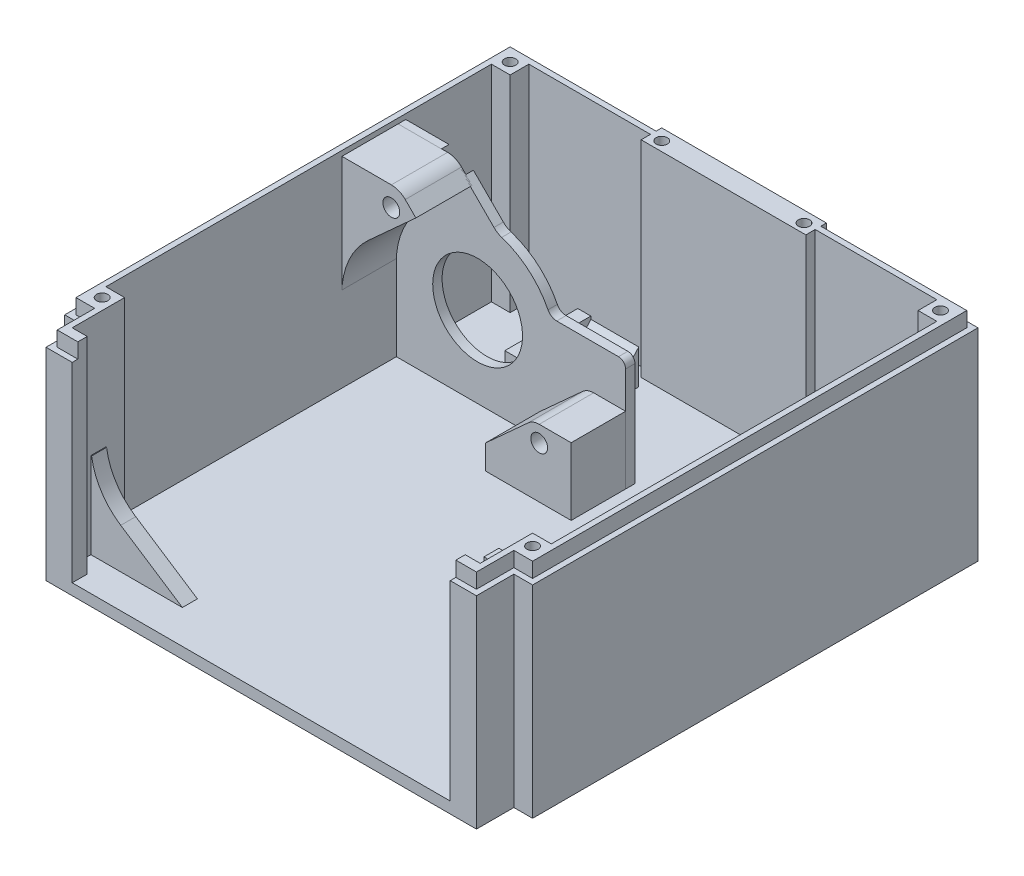
from build123d import *

# Parameters (mm, degrees)
BOSS_EXTRUDE1_DEPTH          = 3
SKETCH2_R                    = 1.5
BOSS_EXTRUDE2_DEPTH          = 55
SKETCH14_R                   = 12
SKETCH14_W                   = 1.116798897
SKETCH14_H                   = 21.636114375
BOSS_EXTRUDE10_DEPTH         = 2.5
SKETCH21_R                   = 2.25
BOSS_EXTRUDE11_DEPTH         = 15
BOSS_EXTRUDE11_2_DEPTH       = 15
CUT_EXTRUDE_THIN2_DEPTH      = 107.913516451
CUT_EXTRUDE_THIN2_DEPTH_BACK = 4
BOSS_EXTRUDE15_REACH         = 107.316
BOSS_EXTRUDE15_END_RADIUS    = 12.0269
SKETCH23_W                   = 12.784976471
SKETCH23_H                   = 19.5
SKETCH28_W                   = 3.5
SKETCH28_H                   = 19.5
BOSS_EXTRUDE16_DEPTH         = 10
SKETCH29_W                   = 6
SKETCH29_H                   = 2.5
CUT_EXTRUDE9_DEPTH           = 21
SKETCH31_R                   = 5.5
SKETCH31_R_2                 = 2.25
CUT_EXTRUDE10_DEPTH          = 2
SKETCH35_W                   = 4
SKETCH35_H                   = 52
BOSS_EXTRUDE20_DEPTH         = 4
BOSS_EXTRUDE20_2_DEPTH       = 4
CUT_EXTRUDE18_DEPTH          = 55


with BuildPart() as part:
    # Sketch1 → Boss-Extrude1 (new body)
    with BuildSketch(Plane(origin=(0, 0, 0), x_dir=(1, 0, 0), z_dir=(0, 1, 0))):
        Polygon((-57.5, -54.5), (-57.5, -64.5), (57.5, -64.5), (57.5, -54.5), (62.5, -54.5), (62.5, 64.5), (-62.5, 64.5), (-62.5, -54.5), align=None)
    extrude(amount=BOSS_EXTRUDE1_DEPTH)

    # Sketch2 → Boss-Extrude2 (add)
    with BuildSketch(Plane(origin=(0, 3, 0), x_dir=(1, 0, 0), z_dir=(0, 1, 0))):
        Polygon((57.5, -64.5), (57.5, -54.5), (62.5, -54.5), (62.5, 64.5), (0, 64.5), (-62.5, 64.5), (-62.5, -54.5), (-57.5, -54.5), (-57.5, -64.5), align=None)
        with Locations(Location((-57.5, -49.5, 0), (0, 0, 270))):
            Circle(SKETCH2_R, mode=Mode.SUBTRACT)
        Polygon((-22, 59), (22, 59), (22, 61.5), (54.5, 61.5), (54.5, 56.5), (59.5, 56.5), (59.5, -46.5), (54.5, -46.5), (54.5, -58.5), (-54.5, -58.5), (-54.5, -46.5), (-59.5, -46.5), (-59.5, 56.5), (-54.5, 56.5), (-54.5, 61.5), (-22, 61.5), align=None, mode=Mode.SUBTRACT)
        with Locations(Location((-57.5, 59.5, 0), (0, 0, 270))):
            Circle(SKETCH2_R, mode=Mode.SUBTRACT)
        with Locations(Location((-19, 61.5, 0), (0, 0, 270))):
            Circle(SKETCH2_R, mode=Mode.SUBTRACT)
        with Locations(Location((19, 61.5, 0), (0, 0, 270))):
            Circle(SKETCH2_R, mode=Mode.SUBTRACT)
        with Locations(Location((57.5, 59.5, 0), (0, 0, 270))):
            Circle(SKETCH2_R, mode=Mode.SUBTRACT)
        with Locations(Location((57.5, -49.5, 0), (0, 0, 270))):
            Circle(SKETCH2_R, mode=Mode.SUBTRACT)
    extrude(amount=BOSS_EXTRUDE2_DEPTH)

    # Sketch22 → Cut-Extrude-Thin2 (cut, two sides: drawn at the far end of the back side and taken through both)
    with BuildSketch(Plane(origin=(0, 58, 0), x_dir=(1, 0, 0), z_dir=(0, 1, 0)).offset(-CUT_EXTRUDE_THIN2_DEPTH_BACK)):
        Polygon((-22, 64.5), (-62.5, 64.5), (-62.5, -54.5), (-57.5, -54.5), (-57.5, -64.5), (57.5, -64.5), (57.5, -54.5), (62.5, -54.5), (62.5, 64.5), (22, 64.5), (22, 63), (61, 63), (61, -53), (56, -53), (56, -63), (-56, -63), (-56, -53), (-61, -53), (-61, 63), (-22, 63), align=None)
    extrude(amount=CUT_EXTRUDE_THIN2_DEPTH + CUT_EXTRUDE_THIN2_DEPTH_BACK, mode=Mode.SUBTRACT)

    # Boss-Extrude15: up to this cylinder (the profile starts outside it)
    boss_extrude15_end = Plane(origin=(0, 19.5875, -46.975), z_dir=(-1, 0, 0)) * Cylinder(BOSS_EXTRUDE15_END_RADIUS, 292.760292, mode=Mode.PRIVATE)
    # Sketch23 → Boss-Extrude15 (add, up to the surface)
    with BuildSketch(Plane(origin=(0, 3, 0), x_dir=(1, 0, 0), z_dir=(0, 1, 0)), mode=Mode.PRIVATE) as boss_extrude15_sk1:
        with Locations((26.537246289, 46.75)):
            Rectangle(SKETCH23_W, SKETCH23_H)
    boss_extrude15_tool1 = extrude(boss_extrude15_sk1.sketch, amount=BOSS_EXTRUDE15_REACH, mode=Mode.PRIVATE) - boss_extrude15_end
    add(boss_extrude15_tool1.solids().sort_by_distance((26.537246, 3, -46.75))[0])
    # Sketch23 → Boss-Extrude15 (add, up to the surface)
    with BuildSketch(Plane(origin=(0, 3, 0), x_dir=(1, 0, 0), z_dir=(0, 1, 0)), mode=Mode.PRIVATE) as boss_extrude15_sk2:
        with Locations((-26.537246289, 46.75)):
            Rectangle(SKETCH23_W, SKETCH23_H)
    boss_extrude15_tool2 = extrude(boss_extrude15_sk2.sketch, amount=BOSS_EXTRUDE15_REACH, mode=Mode.PRIVATE) - boss_extrude15_end
    add(boss_extrude15_tool2.solids().sort_by_distance((-26.537246, 3, -46.75))[0])

    # Sketch28 → Boss-Extrude16 (add)
    with BuildSketch(Plane(origin=(0, 3, 0), x_dir=(1, 0, 0), z_dir=(0, 1, 0))):
        with Locations((-34.679734524, 46.75)):
            Rectangle(SKETCH28_W, SKETCH28_H)
        with Locations((34.679734524, 46.75)):
            Rectangle(SKETCH28_W, SKETCH28_H)
    extrude(amount=BOSS_EXTRUDE16_DEPTH)

    # Sketch29 → Cut-Extrude9 (cut)
    with BuildSketch(Plane.XY.offset(-37)):
        with Locations((-26.800748972, 4.264488043)):
            Rectangle(SKETCH29_W, SKETCH29_H)
        with Locations((26.902468668, 4.264488043)):
            Rectangle(SKETCH29_W, SKETCH29_H)
    extrude(amount=-CUT_EXTRUDE9_DEPTH, mode=Mode.SUBTRACT)

    # Sketch36 → Cut-Extrude18 (cut)
    with BuildSketch(Plane(origin=(0, 58, 0), x_dir=(1, 0, 0), z_dir=(0, 1, 0))):
        Polygon((-54.5, -60.5), (-50.5, -60.5), (-50.5, -64.5), (50.5, -64.5), (50.5, -60.5), (54.5, -60.5), (54.5, -55.5), (-54.5, -55.5), align=None)
    extrude(amount=-CUT_EXTRUDE18_DEPTH, mode=Mode.SUBTRACT)


with BuildPart() as body_2:
    # Sketch14 → Boss-Extrude10 (new body)
    # profile 1 of 10: a face of its own
    with BuildSketch(Plane(origin=(0, 0, -31.119001714), x_dir=(-1, 0, 0), z_dir=(0, 0, -1))):
        with BuildLine():
            ThreePointArc((-1.59584635, 23.545273827), (-1.697128881, 23.891187217), (-1.731299201, 24.25))
            Line((-1.731299201, 24.25), (-1.731299201, 3))
            Line((-1.731299201, 3), (58.856776147, 3))
            Line((58.856776147, 3), (58.856776147, 24.636114375))
            ThreePointArc((58.856776147, 24.636114375), (46.326717946, 5.386759507), (23.652937249, 9.052777819))
            Line((23.652937249, 9.052777819), (20.029318508, 12.343765137))
            ThreePointArc((20.029318508, 12.343765137), (18.95461959, 13.077151659), (17.720322917, 13.488667491))
            Line((17.720322917, 13.488667491), (18.204971966, 13.049203274))
            add(Edge.make_bspline(
                [(18.204971966, 13.049203274), (17.633265391, 13.567608463), (16.861430926, 13.567608463)],
                knots=[0.344197313, 0.344197313, 0.344197313, 1.080722269, 1.080722269, 1.080722269], degree=2, weights=[1, 0.932954253, 1]))
            Line((16.861430926, 13.567608463), (11.576216454, 13.567608463))
            add(Edge.make_bspline(
                [(11.576216454, 13.567608463), (11.161964807, 13.567608463), (10.869078119, 13.274721775)],
                knots=[5.212883045, 5.212883045, 5.212883045, 5.998256201, 5.998256201, 5.998256201], degree=2, weights=[1, 0.923884317, 1]))
            Line((10.869078119, 13.274721775), (10.51813319, 12.923776846))
            ThreePointArc((10.51813319, 12.923776846), (5.894136115, 11.465836169), (2.047645264, 14.417352407))
            Line((2.047645264, 14.417352407), (-1.61850388, 22.279505041))
            add(Edge.make_bspline(
                [(-1.61850388, 22.279505041), (-1.303116197, 21.995089756), (-0.911492557, 21.830784457)],
                knots=[0.051587875, 0.051587875, 0.051587875, 0.388465815, 0.388465815, 0.388465815], degree=2, weights=[1, 0.969446087, 0.966947037]))
            Line((-0.911492557, 21.830784457), (-1.59584635, 23.545273827))
        make_face()
    # profile 2 of 10: a face of its own
    with BuildSketch(Plane(origin=(0, 0, -31.119001714), x_dir=(-1, 0, 0), z_dir=(0, 0, -1))):
        with BuildLine():
            Line((-1.731299201, 30.772228751), (-1.731299201, 24.25))
            ThreePointArc((-1.731299201, 24.25), (-1.697128881, 23.891187217), (-1.59584635, 23.545273827))
            ThreePointArc((-1.59584635, 23.545273827), (-0.89663389, 22.67624692), (0.169681285, 22.349019514))
            Line((0.169681285, 22.349019514), (6.849741216, 22.349019514))
            ThreePointArc((6.849741216, 22.349019514), (8.867461366, 21.972817718), (10.614037633, 20.894766821))
            Line((10.614037633, 20.894766821), (20.029318508, 12.343765137))
            Line((20.029318508, 12.343765137), (23.652937249, 9.052777819))
            ThreePointArc((23.652937249, 9.052777819), (46.326717946, 5.386759507), (58.856776147, 24.636114375))
            ThreePointArc((58.856776147, 24.636114375), (57.121955076, 33.004493243), (52.203426683, 39.993588138))
            ThreePointArc((52.203426683, 39.993588138), (42.422819909, 45.174538524), (31.365884521, 44.67785392))
            ThreePointArc((31.365884521, 44.67785392), (24.122107987, 40.633003795), (19.00380593, 34.103371718))
            ThreePointArc((19.00380593, 34.103371718), (18.045725644, 33.059449427), (16.682453808, 32.673209237))
            Line((16.682453808, 32.673209237), (0.169681285, 32.673209237))
            ThreePointArc((0.169681285, 32.673209237), (-1.174514908, 32.116424943), (-1.731299201, 30.772228751))
        make_face()
        with Locations((37.80579566, 24.636114375)):
            Circle(SKETCH14_R, mode=Mode.SUBTRACT)
    # profile 3 of 10: a face of its own
    with BuildSketch(Plane(origin=(0, 0, -31.119001714), x_dir=(-1, 0, 0), z_dir=(0, 0, -1))):
        with BuildLine():
            ThreePointArc((0.169681285, 22.349019514), (-0.89663389, 22.67624692), (-1.59584635, 23.545273827))
            Line((-1.59584635, 23.545273827), (-0.911492557, 21.830784457))
            add(Edge.make_bspline(
                [(-0.911492557, 21.830784457), (-0.447494096, 21.636114375), (0.055700468, 21.636114375)],
                knots=[0.388465815, 0.388465815, 0.388465815, 0.785360087, 0.785360087, 0.785360087], degree=2, weights=[0.966947037, 0.964002769, 1]))
            Line((0.055700468, 21.636114375), (6.805869125, 21.636114375))
            add(Edge.make_bspline(
                [(10.164391553, 20.340143754), (8.735171821, 21.636114375), (6.805869125, 21.636114375)],
                knots=[5.914929134, 5.914929134, 5.914929134, 6.651441481, 6.651441481, 6.651441481], degree=2, weights=[1, 0.932956522, 1]))
            Line((10.164391553, 20.340143754), (17.720322917, 13.488667491))
            ThreePointArc((17.720322917, 13.488667491), (18.95461959, 13.077151659), (20.029318508, 12.343765137))
            Line((20.029318508, 12.343765137), (10.614037633, 20.894766821))
            ThreePointArc((10.614037633, 20.894766821), (8.867461366, 21.972817718), (6.849741216, 22.349019514))
            Line((6.849741216, 22.349019514), (0.169681285, 22.349019514))
        make_face()
    # profile 4 of 10: a face of its own
    with BuildSketch(Plane(origin=(0, 0, -31.119001714), x_dir=(-1, 0, 0), z_dir=(0, 0, -1))):
        with Locations((59.415175596, 13.818057188)):
            Rectangle(SKETCH14_W, SKETCH14_H)
    # profile 5 of 10: a face of its own
    with BuildSketch(Plane(origin=(0, 0, -31.119001714), x_dir=(-1, 0, 0), z_dir=(0, 0, -1))):
        with BuildLine():
            add(Edge.make_bspline(
                [(-0.911492557, 21.830784457), (-0.447494096, 21.636114375), (0.055700468, 21.636114375)],
                knots=[0.388465815, 0.388465815, 0.388465815, 0.785360087, 0.785360087, 0.785360087], degree=2, weights=[0.966947037, 0.964002769, 1]))
            Line((-0.911492557, 21.830784457), (2.047645264, 14.417352407))
            ThreePointArc((2.047645264, 14.417352407), (5.894136115, 11.465836169), (10.51813319, 12.923776846))
            Line((10.51813319, 12.923776846), (10.869078119, 13.274721775))
            add(Edge.make_bspline(
                [(11.576216454, 13.567608463), (11.161964807, 13.567608463), (10.869078119, 13.274721775)],
                knots=[5.212883045, 5.212883045, 5.212883045, 5.998256201, 5.998256201, 5.998256201], degree=2, weights=[1, 0.923884317, 1]))
            Line((11.576216454, 13.567608463), (16.861430926, 13.567608463))
            ThreePointArc((16.861430926, 13.567608463), (17.292686978, 13.547831717), (17.720322917, 13.488667491))
            Line((17.720322917, 13.488667491), (10.164391553, 20.340143754))
            add(Edge.make_bspline(
                [(10.164391553, 20.340143754), (8.735171821, 21.636114375), (6.805869125, 21.636114375)],
                knots=[5.914929134, 5.914929134, 5.914929134, 6.651441481, 6.651441481, 6.651441481], degree=2, weights=[1, 0.932956522, 1]))
            Line((6.805869125, 21.636114375), (0.055700468, 21.636114375))
        make_face()
        with BuildLine():
            ThreePointArc((9.052712114, 16.518358474), (6.688039759, 14.389197922), (4.558879207, 16.753870277))
            ThreePointArc((4.558879207, 16.753870277), (6.923551562, 18.883030829), (9.052712114, 16.518358474))
        make_face(mode=Mode.SUBTRACT)
    # profile 6 of 10: a face of its own
    with BuildSketch(Plane(origin=(0, 0, -31.119001714), x_dir=(-1, 0, 0), z_dir=(0, 0, -1))):
        with BuildLine():
            Line((2.047645264, 14.417352407), (-0.911492557, 21.830784457))
            add(Edge.make_bspline(
                [(-1.61850388, 22.279505041), (-1.303116197, 21.995089756), (-0.911492557, 21.830784457)],
                knots=[0.051587875, 0.051587875, 0.051587875, 0.388465815, 0.388465815, 0.388465815], degree=2, weights=[1, 0.969446087, 0.966947037]))
            Line((-1.61850388, 22.279505041), (2.047645264, 14.417352407))
        make_face()
    # profile 7 of 10: a face of its own
    with BuildSketch(Plane(origin=(0, 0, -31.119001714), x_dir=(-1, 0, 0), z_dir=(0, 0, -1))):
        with BuildLine():
            ThreePointArc((52.203426683, 39.993588138), (57.121955076, 33.004493243), (58.856776147, 24.636114375))
            Line((58.856776147, 24.636114375), (59.973575044, 24.636114375))
            Line((59.973575044, 24.636114375), (59.973575044, 56.636152457))
            Line((59.973575044, 56.636152457), (46.30579566, 56.636152457))
            ThreePointArc((46.30579566, 56.636152457), (50.01813319, 55.098451905), (51.555833742, 51.386114375))
            Line((51.555833742, 51.386114375), (51.555833742, 41.48838285))
            ThreePointArc((51.555833742, 41.48838285), (51.724689728, 40.673860314), (52.203426683, 39.993588138))
        make_face()
    # profile 8 of 10: a face of its own
    with BuildSketch(Plane(origin=(0, 0, -31.119001714), x_dir=(-1, 0, 0), z_dir=(0, 0, -1))):
        with BuildLine():
            ThreePointArc((31.365884521, 44.67785392), (42.422819909, 45.174538524), (52.203426683, 39.993588138))
            ThreePointArc((52.203426683, 39.993588138), (51.724689728, 40.673860314), (51.555833742, 41.48838285))
            ThreePointArc((51.555833742, 41.48838285), (42.998855018, 45.757066875), (33.438051696, 45.94304547))
            ThreePointArc((33.438051696, 45.94304547), (32.477362773, 45.186966142), (31.365884521, 44.67785392))
        make_face()
    # profile 9 of 10: a face of its own
    with BuildSketch(Plane(origin=(0, 0, -31.119001714), x_dir=(-1, 0, 0), z_dir=(0, 0, -1))):
        with BuildLine():
            ThreePointArc((33.438051696, 45.94304547), (42.998855018, 45.757066875), (51.555833742, 41.48838285))
            Line((51.555833742, 41.48838285), (51.555833742, 51.386114375))
            ThreePointArc((51.555833742, 51.386114375), (50.01813319, 55.098451905), (46.30579566, 56.636152457))
            ThreePointArc((46.30579566, 56.636152457), (44.296693067, 56.236517104), (42.593458131, 55.098451905))
            Line((42.593458131, 55.098451905), (33.438051696, 45.94304547))
        make_face()
        with BuildLine():
            ThreePointArc((48.552712114, 51.268358474), (46.188039759, 49.139197922), (44.058879207, 51.503870277))
            ThreePointArc((44.058879207, 51.503870277), (46.423551562, 53.633030829), (48.552712114, 51.268358474))
        make_face(mode=Mode.SUBTRACT)
    # profile 10 of 10: a face of its own
    with BuildSketch(Plane(origin=(0, 0, -31.119001714), x_dir=(-1, 0, 0), z_dir=(0, 0, -1))):
        with BuildLine():
            Line((18.204971966, 13.049203274), (17.720322917, 13.488667491))
            ThreePointArc((17.720322917, 13.488667491), (17.292686978, 13.547831717), (16.861430926, 13.567608463))
            add(Edge.make_bspline(
                [(18.204971966, 13.049203274), (17.633265391, 13.567608463), (16.861430926, 13.567608463)],
                knots=[0.344197313, 0.344197313, 0.344197313, 1.080722269, 1.080722269, 1.080722269], degree=2, weights=[1, 0.932954253, 1]))
        make_face()
    extrude(amount=BOSS_EXTRUDE10_DEPTH)

    # Sketch31 → Cut-Extrude10 (cut)
    # profile 1 of 2: a face of its own
    with BuildSketch(Plane(origin=(0, 0, -33.619001714), x_dir=(-1, 0, 0), z_dir=(0, 0, -1))):
        with Locations((6.80579566, 16.636114375)):
            Circle(SKETCH31_R)
        with Locations((6.80579566, 16.636114375)):
            Circle(SKETCH31_R_2, mode=Mode.SUBTRACT)
    # profile 2 of 2: a face of its own
    with BuildSketch(Plane(origin=(0, 0, -33.619001714), x_dir=(-1, 0, 0), z_dir=(0, 0, -1))):
        with Locations((46.30579566, 51.386114375)):
            Circle(SKETCH31_R)
    extrude(amount=-CUT_EXTRUDE10_DEPTH, mode=Mode.SUBTRACT)


with BuildPart() as body_3:
    # Sketch21 → Boss-Extrude11 (new body)
    with BuildSketch(Plane(origin=(0, 0, -16.569001714), x_dir=(-1, 0, 0), z_dir=(0, 0, -1))):
        with BuildLine():
            Line((59.973575044, 24.636114375), (59.973575044, 56.636152457))
            Line((59.973575044, 56.636152457), (46.30579566, 56.636152457))
            ThreePointArc((46.30579566, 56.636152457), (44.296693067, 56.236517104), (42.593458131, 55.098451905))
            Line((42.593458131, 55.098451905), (39.748267562, 52.253261335))
            Line((39.748267562, 52.253261335), (52.428614329, 40.73691169))
            ThreePointArc((52.428614329, 40.73691169), (57.694345206, 33.439982672), (59.55579566, 24.636114375))
            Line((59.55579566, 24.636114375), (59.973575044, 24.636114375))
        make_face()
        with Locations((46.30579566, 51.386114375)):
            Circle(SKETCH21_R, mode=Mode.SUBTRACT)
    extrude(amount=BOSS_EXTRUDE11_DEPTH)


with BuildPart() as body_4:
    # Sketch21 → Boss-Extrude11 2 (new body)
    with BuildSketch(Plane(origin=(0, 0, -16.569001714), x_dir=(-1, 0, 0), z_dir=(0, 0, -1))):
        with BuildLine():
            Line((-1.731299201, 20.990217365), (-1.731299201, 3))
            Line((-1.731299201, 3), (21.142157347, 3))
            Line((21.142157347, 3), (21.142157347, 9.497568685))
            Line((21.142157347, 9.497568685), (9.733117889, 19.859311144))
            ThreePointArc((9.733117889, 19.859311144), (8.374884912, 20.697662327), (6.80579566, 20.990217365))
            Line((6.80579566, 20.990217365), (-1.731299201, 20.990217365))
        make_face()
        with Locations((6.80579566, 16.636114375)):
            Circle(SKETCH21_R, mode=Mode.SUBTRACT)
    extrude(amount=BOSS_EXTRUDE11_2_DEPTH)


with BuildPart() as body_5:
    # Sketch35 → Boss-Extrude20 (new body)
    with BuildSketch(Plane(origin=(0, 0, 55.5), x_dir=(-1, 0, 0), z_dir=(0, 0, -1))):
        with Locations((-52.5, 29)):
            Rectangle(SKETCH35_W, SKETCH35_H)
    extrude(amount=BOSS_EXTRUDE20_DEPTH)


with BuildPart() as body_6:
    # Sketch35 → Boss-Extrude20 2 (new body)
    with BuildSketch(Plane(origin=(0, 0, 55.5), x_dir=(-1, 0, 0), z_dir=(0, 0, -1))):
        with BuildLine():
            Line((46.538874378, 13.779778633), (30.058342822, 3))
            Line((30.058342822, 3), (54.5, 3))
            Line((54.5, 3), (54.5, 25.946731257))
            Line((54.5, 25.946731257), (54.311662737, 25.932891577))
            ThreePointArc((54.311662737, 25.932891577), (51.728512948, 19.022816741), (46.538874378, 13.779778633))
        make_face()
    extrude(amount=BOSS_EXTRUDE20_2_DEPTH)


solid = Compound([part.part, body_2.part, body_3.part, body_4.part, body_5.part, body_6.part])
